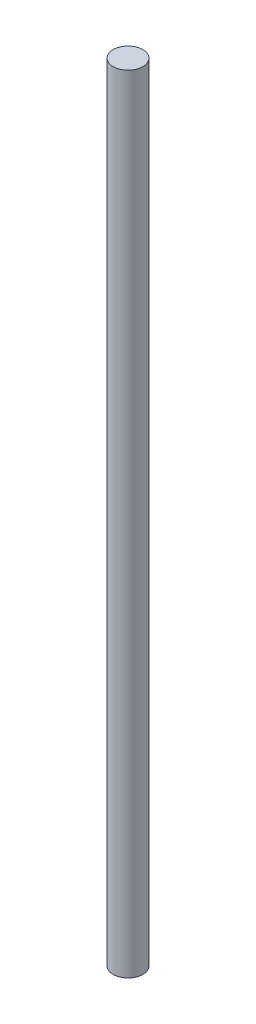
from build123d import *

# Parameters (mm, degrees)
SKETCH_1_R      = 1
EXTRUDE_1_DEPTH = 53


with BuildPart() as part:
    # 草图1 → 凸台-拉伸1 (new body)
    with BuildSketch(Plane(origin=(0, 0, 0), x_dir=(1, 0, 0), z_dir=(0, 1, 0))):
        with Locations(Location((0, 0, 0), (0, 0, 270))):
            Circle(SKETCH_1_R)
    extrude(amount=EXTRUDE_1_DEPTH)


solid = part.part
